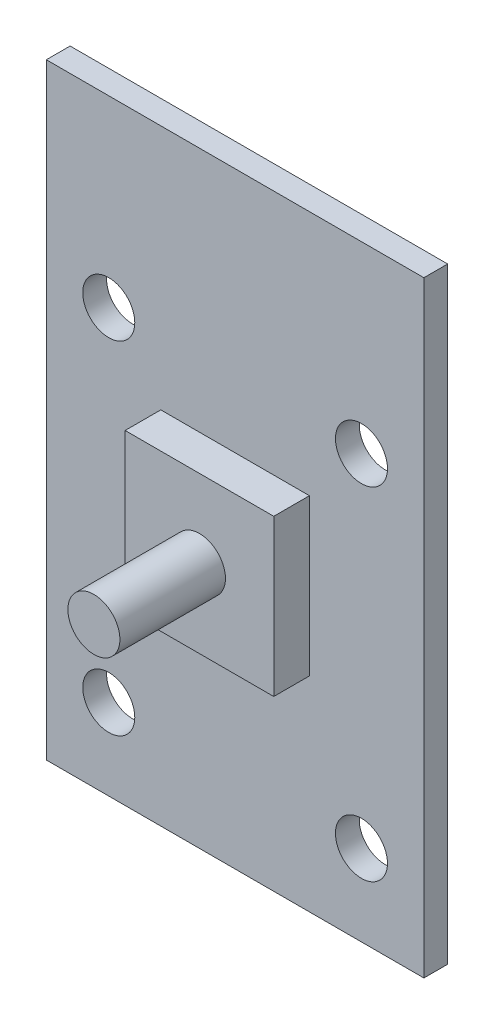
from build123d import *

# Parameters (mm, degrees)
ESQUISSE1_W        = 25.4
ESQUISSE1_H        = 40.8
ESQUISSE1_R        = 1.75
ESQUISSE1_R_2      = 1.816105755
BOSS_EXTRU_1_DEPTH = 1.6
ESQUISSE2_W        = 10
ESQUISSE2_H        = 10.5
BOSS_EXTRU_2_DEPTH = 2.4
ESQUISSE3_R        = 1.75
BOSS_EXTRU_3_DEPTH = 7.1


with BuildPart() as part:
    # Esquisse1 → Boss.-Extru.1 (new body)
    with BuildSketch(Plane.XY):
        with Locations((54.255448742, 40.424731349)):
            Rectangle(ESQUISSE1_W, ESQUISSE1_H)
        with Locations((62.755448742, 25.479221209)):
            Circle(ESQUISSE1_R, mode=Mode.SUBTRACT)
        with Locations((45.755448742, 25.479221209)):
            Circle(ESQUISSE1_R, mode=Mode.SUBTRACT)
        with Locations((62.755448742, 48.479221209)):
            Circle(ESQUISSE1_R, mode=Mode.SUBTRACT)
        with Locations((45.755448742, 48.479221209)):
            Circle(ESQUISSE1_R, mode=Mode.SUBTRACT)
        with Locations((54.255448742, 39.024731349)):
            Circle(ESQUISSE1_R_2, mode=Mode.SUBTRACT)
    extrude(amount=BOSS_EXTRU_1_DEPTH)

    # Esquisse2 → Boss.-Extru.2 (add)
    with BuildSketch(Plane.XY.offset(1.6)):
        with Locations((54.255448742, 39.024731349)):
            Rectangle(ESQUISSE2_W, ESQUISSE2_H)
    extrude(amount=BOSS_EXTRU_2_DEPTH)

    # Esquisse3 → Boss.-Extru.3 (add)
    with BuildSketch(Plane.XY.offset(4)):
        with Locations((54.255448742, 39.024731349)):
            Circle(ESQUISSE3_R)
    extrude(amount=BOSS_EXTRU_3_DEPTH)


solid = part.part
